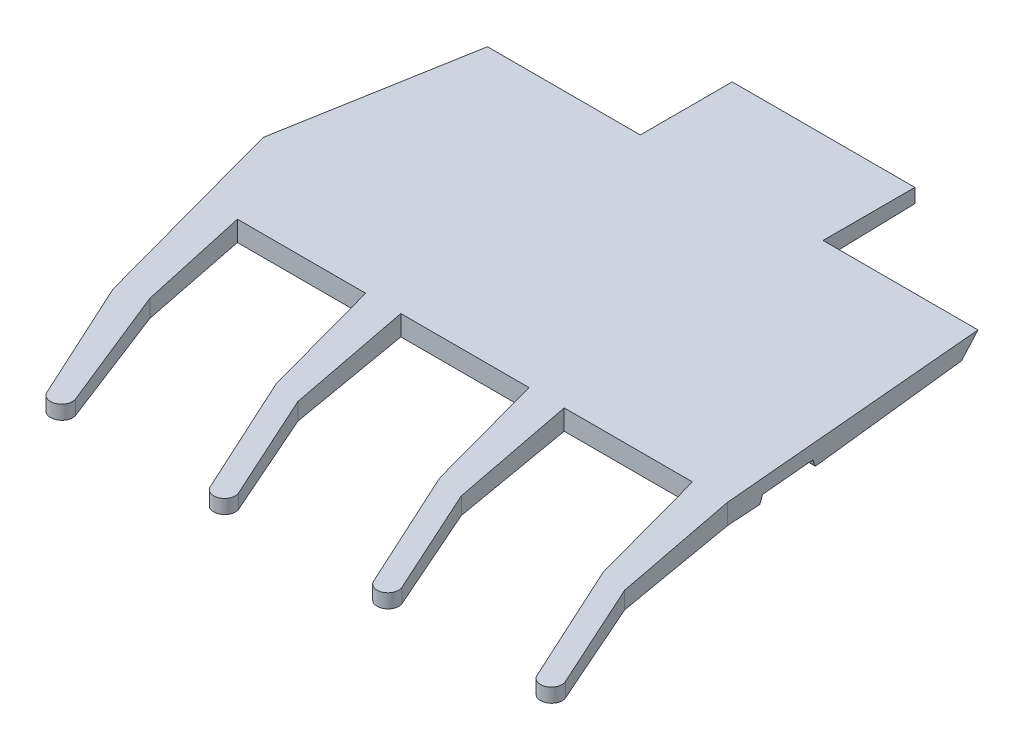
from build123d import *

# Parameters (mm, degrees)
BOSS_EXTRUDE1_START = -16
BOSS_EXTRUDE1_DEPTH = 89.157051
SKETCH3_OUTSIDE_W   = 116.287
SKETCH3_OUTSIDE_H   = 115.611
CUT_EXTRUDE1_DEPTH  = 88.677780629
CUT_EXTRUDE2_START  = 10.52923
CUT_EXTRUDE2_DEPTH  = 98.513759981
CUT_EXTRUDE3_START  = 36.52923
CUT_EXTRUDE3_DEPTH  = 51.455299981


with BuildPart() as part:
    # Sketch2 → Boss-Extrude1 (new body)
    with BuildSketch(Plane(origin=(0, 0, 0), x_dir=(0, 0, -1), z_dir=(1, 0, 0)).offset(BOSS_EXTRUDE1_START)):
        Polygon((1.783532587, -3.008705321), (40.247767664, -2.004301248), (40.22160329, 0), (-48.232632079, 0), (-48.232632079, -1.965470246), (-6.861445597, -3.00715824), (-6.448065556, -2.007232202), (1.370510461, -2.008631392), align=None)
    extrude(amount=BOSS_EXTRUDE1_DEPTH)

    # Sketch3 outside → Cut-Extrude1 (cut, through all)
    with BuildSketch(Plane(origin=(0, 0, 0), x_dir=(1, 0, 0), z_dir=(0, 1, 0))):
        with Locations((28.5785, -3.9925)):
            Rectangle(SKETCH3_OUTSIDE_W, SKETCH3_OUTSIDE_H)
        with BuildLine():
            Line((-16, 0), (-7.992764086, -29.362208482))
            Line((-7.992764086, -29.362208482), (0.009083526, -46.765523098))
            ThreePointArc((0.009083526, -46.765523098), (2.039982857, -47.545155183), (2.868544584, -45.533721926))
            Line((2.868544584, -45.533721926), (-4.233993603, -27.882047686))
            Line((-4.233993603, -27.882047686), (-7.754483566, -11.901176784))
            Line((-7.754483566, -11.901176784), (10.497010956, -11.901176784))
            Line((10.497010956, -11.901176784), (15.258730436, -29.362208482))
            Line((15.258730436, -29.362208482), (23.274636539, -46.796099079))
            ThreePointArc((23.274636539, -46.796099079), (25.294023142, -47.545803313), (26.047958994, -45.527992762))
            Line((26.047958994, -45.527992762), (19.017500919, -30.066904431))
            Line((19.017500919, -30.066904431), (15.497010956, -11.901176784))
            Line((15.497010956, -11.901176784), (33.748505478, -11.901176784))
            Line((33.748505478, -11.901176784), (38.510224958, -29.362208482))
            Line((38.510224958, -29.362208482), (46.526131062, -46.796099079))
            ThreePointArc((46.526131062, -46.796099079), (48.545517664, -47.545803313), (49.299453516, -45.527992762))
            Line((49.299453516, -45.527992762), (42.268995441, -30.066904431))
            Line((42.268995441, -30.066904431), (38.748505478, -11.901176784))
            Line((38.748505478, -11.901176784), (57, -11.901176784))
            Line((57, -11.901176784), (61.76171948, -29.362208482))
            Line((61.76171948, -29.362208482), (69.777625584, -46.796099079))
            ThreePointArc((69.777625584, -46.796099079), (71.797012186, -47.545803313), (72.550948038, -45.527992762))
            Line((72.550948038, -45.527992762), (65.520489963, -30.066904431))
            Line((65.520489963, -30.066904431), (62, -11.901176784))
            Line((62, -11.901176784), (57.439847632, 40.22160329))
            Line((57.439847632, 40.22160329), (-8.907846133, 40.22160329))
            Line((-8.907846133, 40.22160329), (-16, 0))
        make_face(mode=Mode.SUBTRACT)
    extrude(amount=-CUT_EXTRUDE1_DEPTH, mode=Mode.SUBTRACT)

    # Sketch4 → Cut-Extrude2 (cut, through all)
    with BuildSketch(Plane(origin=(0, 0, 0), x_dir=(0, 0, -1), z_dir=(1, 0, 0)).offset(CUT_EXTRUDE2_START)):
        Polygon((24.567378522, -2.413758155), (27.144470315, 0), (40.22160329, 0), (40.247767664, -2.004301248), align=None)
    extrude(amount=-CUT_EXTRUDE2_DEPTH, mode=Mode.SUBTRACT)

    # Sketch4<2> → Cut-Extrude3 (cut, through all)
    with BuildSketch(Plane(origin=(0, 0, 0), x_dir=(0, 0, -1), z_dir=(1, 0, 0)).offset(CUT_EXTRUDE3_START)):
        Polygon((24.567378522, -2.413758155), (27.144470315, 0), (40.22160329, 0), (40.247767664, -2.004301248), align=None)
    extrude(amount=CUT_EXTRUDE3_DEPTH, mode=Mode.SUBTRACT)


solid = part.part
